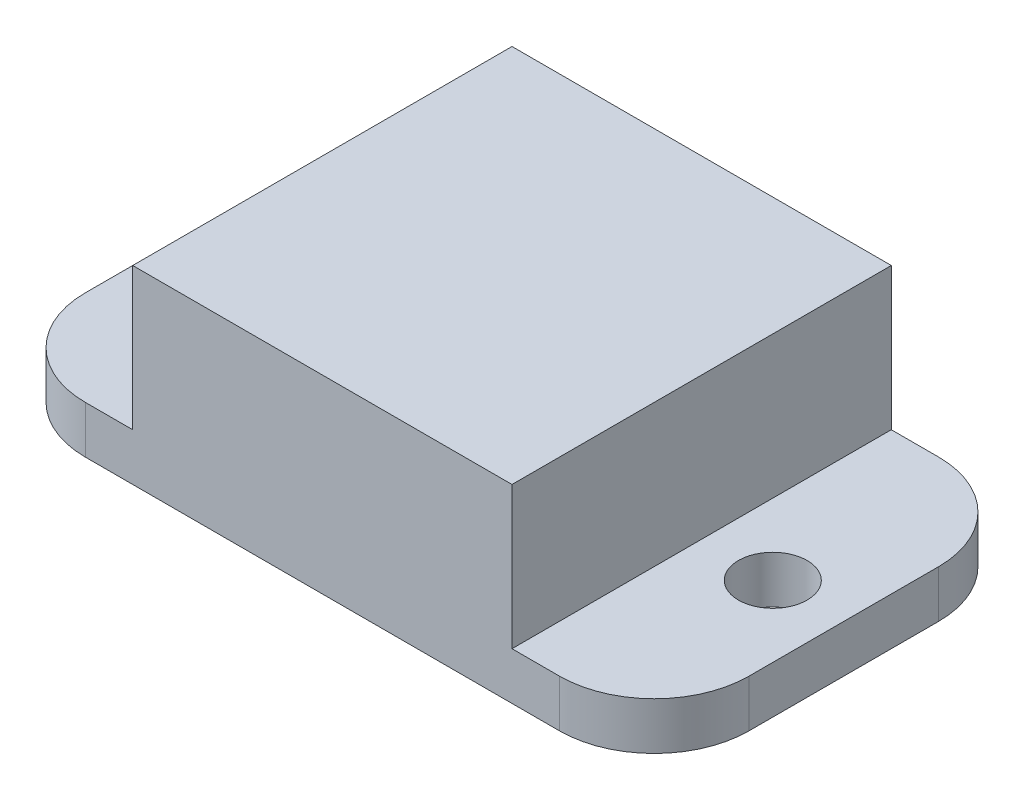
from build123d import *

# Parameters (mm, degrees)
BOSS_EXTRUDE1_DEPTH     = 25.4
CUT_EXTRUDE1_DEPTH      = 53.073871807
CUT_EXTRUDE1_DEPTH_BACK = 53.073871807
SKETCH2_R               = 2.3
FILLET1_R               = 6.35


with BuildPart() as part:
    # Sketch1 → Boss-Extrude1 (new body)
    with BuildSketch(Plane.XY):
        Polygon((0, 0), (0, 3.175), (9.525, 3.175), (9.525, 12.7), (34.925, 12.7), (34.925, 3.175), (44.45, 3.175), (44.45, 0), align=None)
    extrude(amount=BOSS_EXTRUDE1_DEPTH)

    # Sketch2 → Cut-Extrude1 (cut, two sides: drawn at the far end of the back side and taken through both)
    with BuildSketch(Plane(origin=(0, 3.175, 0), x_dir=(1, 0, 0), z_dir=(0, 1, 0)).offset(-CUT_EXTRUDE1_DEPTH_BACK)):
        with Locations(Location((4.7625, -12.7, 0), (0, 0, 270))):
            Circle(SKETCH2_R)
        with Locations(Location((39.6875, -12.7, 0), (0, 0, 270))):
            Circle(SKETCH2_R)
    extrude(amount=CUT_EXTRUDE1_DEPTH + CUT_EXTRUDE1_DEPTH_BACK, mode=Mode.SUBTRACT)

    # Fillet1
    fillet1_edges = [part.edges().sort_by_distance(p)[0] for p in [
        (44.45, 1.5875, 0),
        (0, 1.5875, 25.4),
        (0, 1.5875, 0),
        (44.45, 1.5875, 25.4),
    ]]
    fillet(fillet1_edges, radius=FILLET1_R)


solid = part.part
